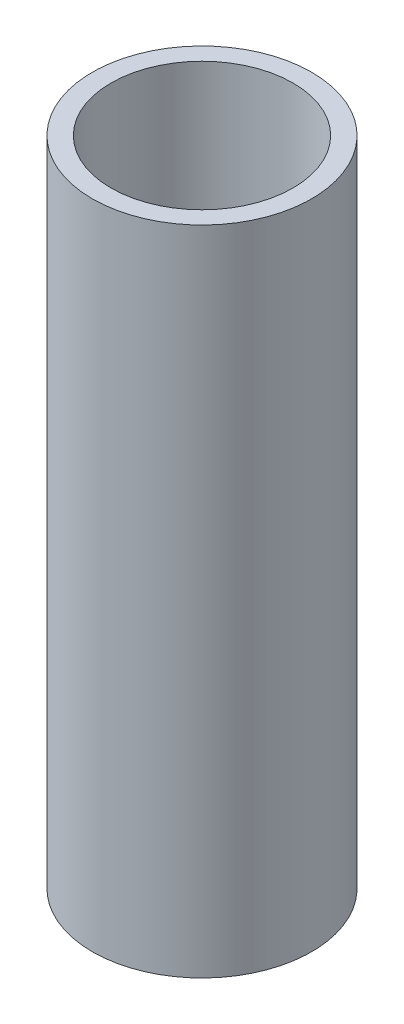
from build123d import *

# Parameters (mm, degrees)
SKETCH2_R           = 4.7752
BOSS_EXTRUDE1_DEPTH = 28.3972
SKETCH3_R           = 3.9624
CUT_EXTRUDE1_DEPTH  = 28.3972


with BuildPart() as part:
    # Sketch2 → Boss-Extrude1 (new body)
    with BuildSketch(Plane(origin=(0, 0, 0), x_dir=(1, 0, 0), z_dir=(0, 1, 0))):
        with Locations(Location((0, 0, 0), (0, 0, 90))):
            Circle(SKETCH2_R)
    extrude(amount=BOSS_EXTRUDE1_DEPTH)

    # Sketch3 → Cut-Extrude1 (cut)
    with BuildSketch(Plane(origin=(0, 28.3972, 0), x_dir=(1, 0, 0), z_dir=(0, 1, 0))):
        with Locations(Location((0, 0, 0), (0, 0, 270))):
            Circle(SKETCH3_R)
    extrude(amount=-CUT_EXTRUDE1_DEPTH, mode=Mode.SUBTRACT)


solid = part.part
